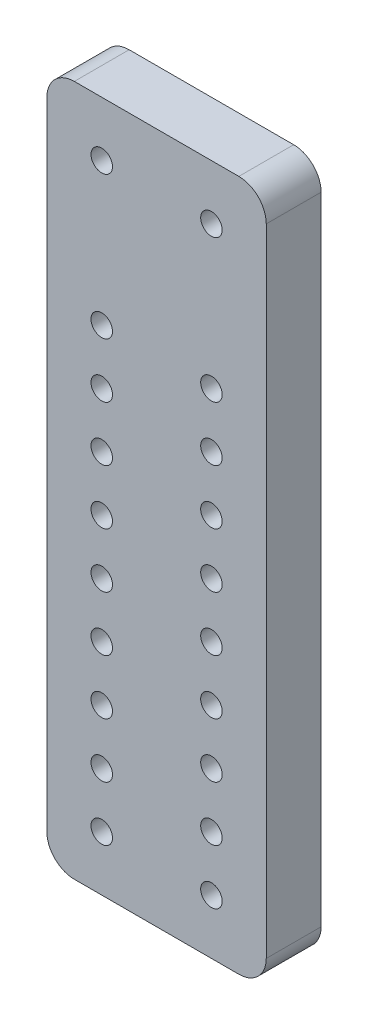
from build123d import *

# Parameters (mm, degrees)
SKETCH2_W           = 50.8
SKETCH2_H           = 160.02
BOSS_EXTRUDE1_DEPTH = 12.7
SKETCH3_R           = 2.4892
CUT_EXTRUDE1_DEPTH  = 169.369624339
FILLET1_R           = 6.35


with BuildPart() as part:
    # Sketch2 → Boss-Extrude1 (new body)
    with BuildSketch(Plane.XY):
        with Locations((25.4, 80.01)):
            Rectangle(SKETCH2_W, SKETCH2_H)
    extrude(amount=-BOSS_EXTRUDE1_DEPTH)

    # Sketch3 → Cut-Extrude1 (cut, through all)
    with BuildSketch(Plane.XY):
        with Locations((12.7, 147.32)):
            Circle(SKETCH3_R)
        with Locations((38.1, 147.32)):
            Circle(SKETCH3_R)
        with Locations((12.7, 114.3)):
            Circle(SKETCH3_R)
        with Locations((12.7, 101.6)):
            Circle(SKETCH3_R)
        with Locations((12.7, 88.9)):
            Circle(SKETCH3_R)
        with Locations((12.7, 76.2)):
            Circle(SKETCH3_R)
        with Locations((12.7, 63.5)):
            Circle(SKETCH3_R)
        with Locations((12.7, 50.8)):
            Circle(SKETCH3_R)
        with Locations((12.7, 38.1)):
            Circle(SKETCH3_R)
        with Locations((12.7, 25.4)):
            Circle(SKETCH3_R)
        with Locations((12.7, 12.7)):
            Circle(SKETCH3_R)
        with Locations((38.1, 101.6)):
            Circle(SKETCH3_R)
        with Locations((38.1, 88.9)):
            Circle(SKETCH3_R)
        with Locations((38.1, 76.2)):
            Circle(SKETCH3_R)
        with Locations((38.1, 63.5)):
            Circle(SKETCH3_R)
        with Locations((38.1, 50.8)):
            Circle(SKETCH3_R)
        with Locations((38.1, 38.1)):
            Circle(SKETCH3_R)
        with Locations((38.1, 25.4)):
            Circle(SKETCH3_R)
        with Locations((38.1, 12.7)):
            Circle(SKETCH3_R)
        with Locations((38.1, 114.3)):
            Circle(SKETCH3_R)
    extrude(amount=-CUT_EXTRUDE1_DEPTH, mode=Mode.SUBTRACT)

    # Fillet1
    fillet1_edges = [part.edges().sort_by_distance(p)[0] for p in [
        (0, 160.02, -6.35),
        (50.8, 160.02, -6.35),
        (50.8, 0, -6.35),
        (0, 0, -6.35),
    ]]
    fillet(fillet1_edges, radius=FILLET1_R)


solid = part.part
